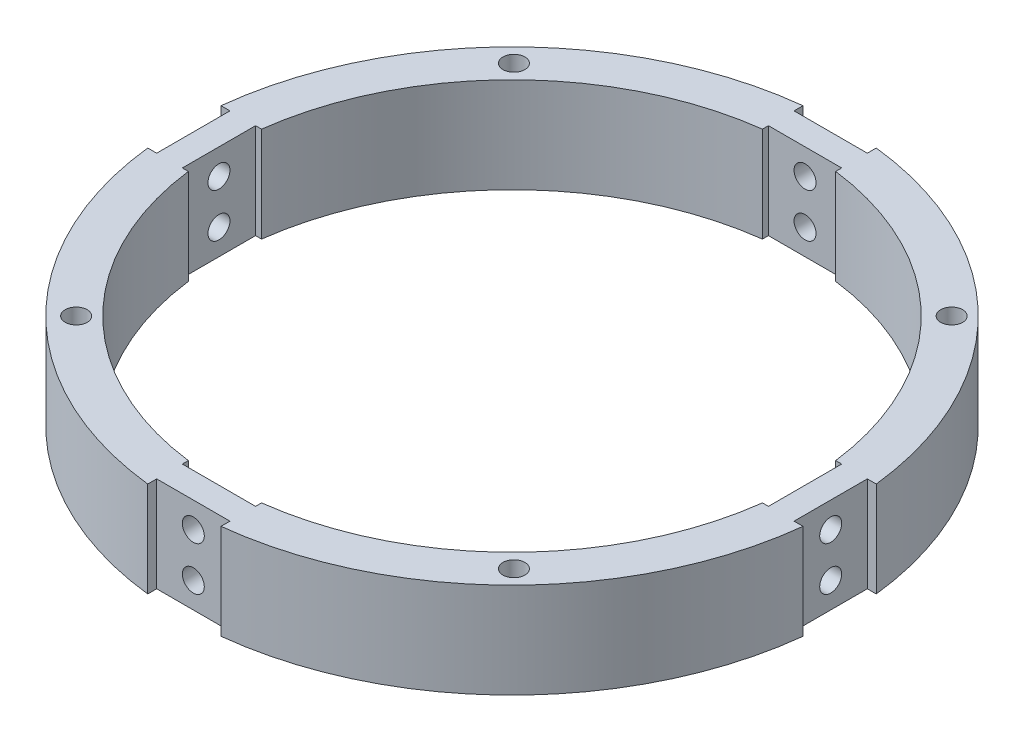
from build123d import *

# Parameters (mm, degrees)
BOSS_EXTRUDE1_DEPTH      = 13
BOSS_EXTRUDE1_DEPTH_BACK = 13
SKETCH1_R                = 90
SKETCH1_R_2              = 79
SKETCH5_R                = 3
CUT_EXTRUDE3_DEPTH       = 130.907659512
SKETCH6_W                = 20
SKETCH6_H                = 3
SKETCH6_W_2              = 3
SKETCH6_H_2              = 20
CUT_EXTRUDE4_DEPTH       = 130.907659512
SKETCH7_R                = 3
CUT_EXTRUDE5_DEPTH       = 199.244881708
SKETCH12_R               = 3
CUT_EXTRUDE8_DEPTH       = 199.244881715
SKETCH13_W               = 20
SKETCH13_H               = 3
SKETCH13_W_2             = 3
SKETCH13_H_2             = 20
CUT_EXTRUDE9_DEPTH       = 130.135587679


with BuildPart() as part:
    # Sketch1 → Boss-Extrude1 (new, two sides: drawn at the far end of the back side and taken through both)
    with BuildSketch(Plane(origin=(0, 0, 0), x_dir=(1, 0, 0), z_dir=(0, 1, 0)).offset(-BOSS_EXTRUDE1_DEPTH_BACK)):
        Circle(SKETCH1_R)
        Circle(SKETCH1_R_2, mode=Mode.SUBTRACT)
    extrude(amount=BOSS_EXTRUDE1_DEPTH + BOSS_EXTRUDE1_DEPTH_BACK)

    # Sketch5 → Cut-Extrude3 (cut, through all)
    with BuildSketch(Plane(origin=(0, 13, 0), x_dir=(1, 0, 0), z_dir=(0, 1, 0))):
        with Locations((60.012131098, 60.012131098)):
            Circle(SKETCH5_R)
        with Locations((60.012131098, -59.488914922)):
            Circle(SKETCH5_R)
        with Locations((-59.488914922, -59.488914922)):
            Circle(SKETCH5_R)
        with Locations((-59.488914922, 60.012131098)):
            Circle(SKETCH5_R)
    extrude(amount=-CUT_EXTRUDE3_DEPTH, mode=Mode.SUBTRACT)

    # Sketch6 → Cut-Extrude4 (cut, through all)
    with BuildSketch(Plane(origin=(0, 13, 0), x_dir=(1, 0, 0), z_dir=(0, 1, 0))):
        with Locations((0, -88.5)):
            Rectangle(SKETCH6_W, SKETCH6_H)
        with Locations((0, 88.5)):
            Rectangle(SKETCH6_W, SKETCH6_H)
        with Locations((88.5, 0)):
            Rectangle(SKETCH6_W_2, SKETCH6_H_2)
        with Locations((-88.5, 0)):
            Rectangle(SKETCH6_W_2, SKETCH6_H_2)
    extrude(amount=-CUT_EXTRUDE4_DEPTH, mode=Mode.SUBTRACT)

    # Sketch7 → Cut-Extrude5 (cut, through all)
    with BuildSketch(Plane.ZY.offset(87)):
        with Locations((0, 6)):
            Circle(SKETCH7_R)
        with Locations((0, -6)):
            Circle(SKETCH7_R)
    extrude(amount=-CUT_EXTRUDE5_DEPTH, mode=Mode.SUBTRACT)

    # Sketch12 → Cut-Extrude8 (cut, through all)
    with BuildSketch(Plane.XY.offset(87)):
        with Locations((0, 6)):
            Circle(SKETCH12_R)
        with Locations((0, -6)):
            Circle(SKETCH12_R)
    extrude(amount=-CUT_EXTRUDE8_DEPTH, mode=Mode.SUBTRACT)

    # Sketch13 → Cut-Extrude9 (cut, through all)
    with BuildSketch(Plane(origin=(0, 13, 0), x_dir=(1, 0, 0), z_dir=(0, 1, 0))):
        with Locations((0, -78.5)):
            Rectangle(SKETCH13_W, SKETCH13_H)
        with Locations((0, 78.5)):
            Rectangle(SKETCH13_W, SKETCH13_H)
        with Locations((-78.5, 0)):
            Rectangle(SKETCH13_W_2, SKETCH13_H_2)
        with Locations((78.5, 0)):
            Rectangle(SKETCH13_W_2, SKETCH13_H_2)
    extrude(amount=-CUT_EXTRUDE9_DEPTH, mode=Mode.SUBTRACT)


solid = part.part
